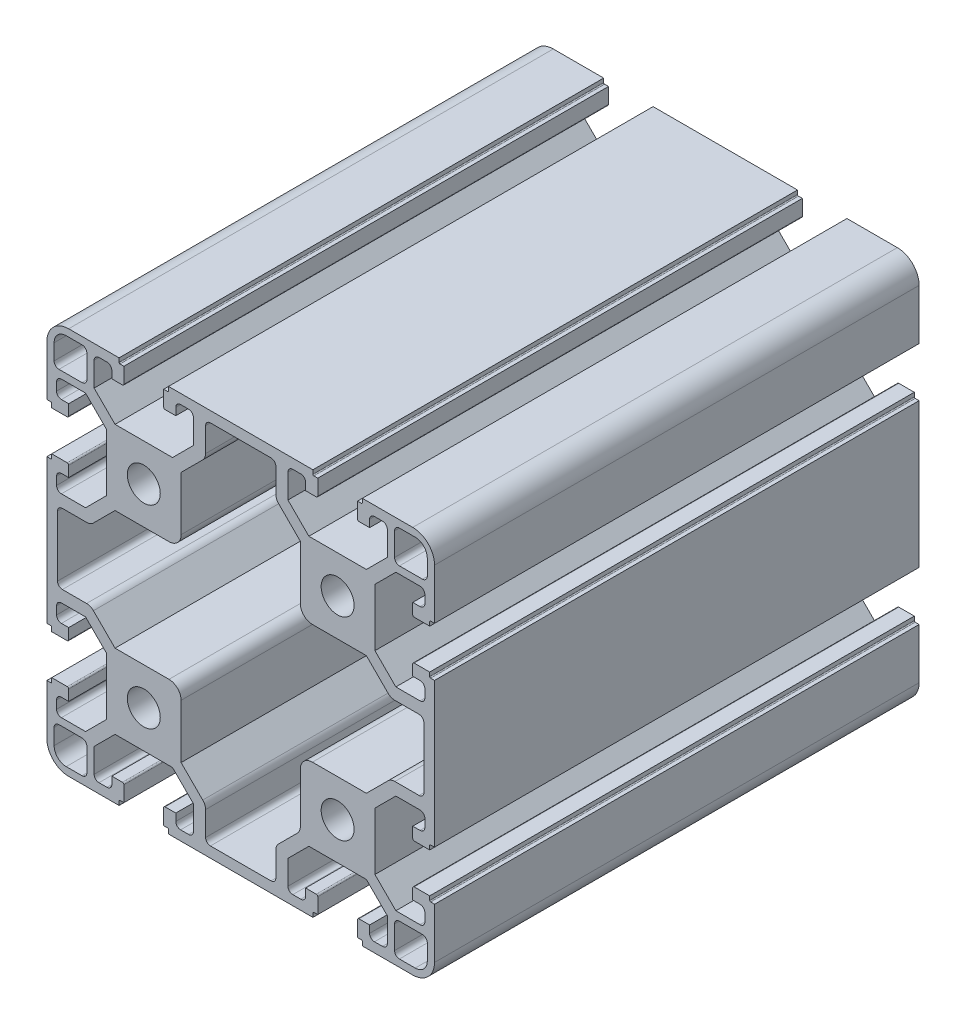
from build123d import *

# Parameters (mm, degrees)
SKETCH_1_R      = 3.4
EXTRUDE_1_DEPTH = 100


with BuildPart() as part:
    # 草图1 → 凸台-拉伸1 (new body)
    with BuildSketch(Plane.XY):
        with BuildLine():
            Line((28.48472507, 26.552635346), (32.802492023, 30.870402299))
            Line((32.802492023, 30.870402299), (37.78472507, 30.870402299))
            ThreePointArc((37.78472507, 30.870402299), (38.491831851, 30.57750908), (38.78472507, 29.870402299))
            Line((38.78472507, 29.870402299), (38.78472507, 28.220402299))
            ThreePointArc((38.78472507, 28.220402299), (38.491831851, 27.513295518), (37.78472507, 27.220402299))
            Line((37.78472507, 27.220402299), (36.28472507, 27.220402299))
            Line((36.28472507, 27.220402299), (36.28472507, 25.020402299))
            ThreePointArc((36.28472507, 25.020402299), (36.372593036, 24.808270264), (36.58472507, 24.720402299))
            Line((36.58472507, 24.720402299), (39.78472507, 24.720402299))
            Line((39.78472507, 24.720402299), (39.78472507, 25.520402299))
            ThreePointArc((39.78472507, 25.520402299), (39.843303714, 25.661823655), (39.98472507, 25.720402299))
            Line((39.98472507, 25.720402299), (40.78472507, 25.720402299))
            Line((40.78472507, 25.720402299), (40.78472507, 36.120402299))
            ThreePointArc((40.78472507, 36.120402299), (39.466705585, 39.302382814), (36.28472507, 40.620402299))
            Line((36.28472507, 40.620402299), (25.88472507, 40.620402299))
            Line((25.88472507, 40.620402299), (25.88472507, 39.820402299))
            ThreePointArc((25.88472507, 39.820402299), (25.826146426, 39.678980943), (25.68472507, 39.620402299))
            Line((25.68472507, 39.620402299), (24.88472507, 39.620402299))
            Line((24.88472507, 39.620402299), (24.88472507, 36.420402299))
            ThreePointArc((24.88472507, 36.420402299), (24.972593036, 36.208270264), (25.18472507, 36.120402299))
            Line((25.18472507, 36.120402299), (27.38472507, 36.120402299))
            Line((27.38472507, 36.120402299), (27.38472507, 37.620402299))
            ThreePointArc((27.38472507, 37.620402299), (27.677618289, 38.32750908), (28.38472507, 38.620402299))
            Line((28.38472507, 38.620402299), (30.03472507, 38.620402299))
            ThreePointArc((30.03472507, 38.620402299), (30.741831851, 38.32750908), (31.03472507, 37.620402299))
            Line((31.03472507, 37.620402299), (31.03472507, 32.638169252))
            Line((31.03472507, 32.638169252), (26.716958117, 28.320402299))
            Line((26.716958117, 28.320402299), (14.852492023, 28.320402299))
            Line((14.852492023, 28.320402299), (10.53472507, 32.638169252))
            Line((10.53472507, 32.638169252), (10.53472507, 37.620402299))
            ThreePointArc((10.53472507, 37.620402299), (10.827618289, 38.32750908), (11.53472507, 38.620402299))
            Line((11.53472507, 38.620402299), (13.18472507, 38.620402299))
            ThreePointArc((13.18472507, 38.620402299), (13.891831851, 38.32750908), (14.18472507, 37.620402299))
            Line((14.18472507, 37.620402299), (14.18472507, 36.120402299))
            Line((14.18472507, 36.120402299), (16.38472507, 36.120402299))
            ThreePointArc((16.38472507, 36.120402299), (16.596857104, 36.208270264), (16.68472507, 36.420402299))
            Line((16.68472507, 36.420402299), (16.68472507, 39.620402299))
            Line((16.68472507, 39.620402299), (15.88472507, 39.620402299))
            ThreePointArc((15.88472507, 39.620402299), (15.743303714, 39.678980943), (15.68472507, 39.820402299))
            Line((15.68472507, 39.820402299), (15.68472507, 40.620402299))
            Line((15.68472507, 40.620402299), (5.28472507, 40.620402299))
            Line((5.28472507, 40.620402299), (-3.71527493, 40.620402299))
            Line((-3.71527493, 40.620402299), (-14.11527493, 40.620402299))
            Line((-14.11527493, 40.620402299), (-14.11527493, 39.820402299))
            ThreePointArc((-14.11527493, 39.820402299), (-14.173853574, 39.678980943), (-14.31527493, 39.620402299))
            Line((-14.31527493, 39.620402299), (-15.11527493, 39.620402299))
            Line((-15.11527493, 39.620402299), (-15.11527493, 36.420402299))
            ThreePointArc((-15.11527493, 36.420402299), (-15.027406964, 36.208270264), (-14.81527493, 36.120402299))
            Line((-14.81527493, 36.120402299), (-12.61527493, 36.120402299))
            Line((-12.61527493, 36.120402299), (-12.61527493, 37.620402299))
            ThreePointArc((-12.61527493, 37.620402299), (-12.322381711, 38.32750908), (-11.61527493, 38.620402299))
            Line((-11.61527493, 38.620402299), (-9.96527493, 38.620402299))
            ThreePointArc((-9.96527493, 38.620402299), (-9.258168149, 38.32750908), (-8.96527493, 37.620402299))
            Line((-8.96527493, 37.620402299), (-8.96527493, 32.638169252))
            Line((-8.96527493, 32.638169252), (-13.283041883, 28.320402299))
            Line((-13.283041883, 28.320402299), (-25.147507977, 28.320402299))
            Line((-25.147507977, 28.320402299), (-29.46527493, 32.638169252))
            Line((-29.46527493, 32.638169252), (-29.46527493, 37.620402299))
            ThreePointArc((-29.46527493, 37.620402299), (-29.172381711, 38.32750908), (-28.46527493, 38.620402299))
            Line((-28.46527493, 38.620402299), (-26.81527493, 38.620402299))
            ThreePointArc((-26.81527493, 38.620402299), (-26.108168149, 38.32750908), (-25.81527493, 37.620402299))
            Line((-25.81527493, 37.620402299), (-25.81527493, 36.120402299))
            Line((-25.81527493, 36.120402299), (-23.61527493, 36.120402299))
            ThreePointArc((-23.61527493, 36.120402299), (-23.403142896, 36.208270264), (-23.31527493, 36.420402299))
            Line((-23.31527493, 36.420402299), (-23.31527493, 39.620402299))
            Line((-23.31527493, 39.620402299), (-24.11527493, 39.620402299))
            ThreePointArc((-24.11527493, 39.620402299), (-24.256696286, 39.678980943), (-24.31527493, 39.820402299))
            Line((-24.31527493, 39.820402299), (-24.31527493, 40.620402299))
            Line((-24.31527493, 40.620402299), (-34.71527493, 40.620402299))
            ThreePointArc((-34.71527493, 40.620402299), (-37.897255445, 39.302382814), (-39.21527493, 36.120402299))
            Line((-39.21527493, 36.120402299), (-39.21527493, 25.720402299))
            Line((-39.21527493, 25.720402299), (-38.41527493, 25.720402299))
            ThreePointArc((-38.41527493, 25.720402299), (-38.273853574, 25.661823655), (-38.21527493, 25.520402299))
            Line((-38.21527493, 25.520402299), (-38.21527493, 24.720402299))
            Line((-38.21527493, 24.720402299), (-35.01527493, 24.720402299))
            ThreePointArc((-35.01527493, 24.720402299), (-34.803142896, 24.808270264), (-34.71527493, 25.020402299))
            Line((-34.71527493, 25.020402299), (-34.71527493, 27.220402299))
            Line((-34.71527493, 27.220402299), (-36.21527493, 27.220402299))
            ThreePointArc((-36.21527493, 27.220402299), (-36.922381711, 27.513295518), (-37.21527493, 28.220402299))
            Line((-37.21527493, 28.220402299), (-37.21527493, 29.870402299))
            ThreePointArc((-37.21527493, 29.870402299), (-36.922381711, 30.57750908), (-36.21527493, 30.870402299))
            Line((-36.21527493, 30.870402299), (-31.233041883, 30.870402299))
            Line((-31.233041883, 30.870402299), (-26.91527493, 26.552635346))
            Line((-26.91527493, 26.552635346), (-26.91527493, 14.688169252))
            Line((-26.91527493, 14.688169252), (-31.233041883, 10.370402299))
            Line((-31.233041883, 10.370402299), (-36.21527493, 10.370402299))
            ThreePointArc((-36.21527493, 10.370402299), (-36.922381711, 10.663295518), (-37.21527493, 11.370402299))
            Line((-37.21527493, 11.370402299), (-37.21527493, 13.020402299))
            ThreePointArc((-37.21527493, 13.020402299), (-36.922381711, 13.72750908), (-36.21527493, 14.020402299))
            Line((-36.21527493, 14.020402299), (-34.71527493, 14.020402299))
            Line((-34.71527493, 14.020402299), (-34.71527493, 16.220402299))
            ThreePointArc((-34.71527493, 16.220402299), (-34.803142896, 16.432534333), (-35.01527493, 16.520402299))
            Line((-35.01527493, 16.520402299), (-38.21527493, 16.520402299))
            Line((-38.21527493, 16.520402299), (-38.21527493, 15.720402299))
            ThreePointArc((-38.21527493, 15.720402299), (-38.273853574, 15.578980943), (-38.41527493, 15.520402299))
            Line((-38.41527493, 15.520402299), (-39.21527493, 15.520402299))
            Line((-39.21527493, 15.520402299), (-39.21527493, 5.120402299))
            Line((-39.21527493, 5.120402299), (-39.21527493, -3.879597701))
            Line((-39.21527493, -3.879597701), (-39.21527493, -14.279597701))
            Line((-39.21527493, -14.279597701), (-38.41527493, -14.279597701))
            ThreePointArc((-38.41527493, -14.279597701), (-38.273853574, -14.338176345), (-38.21527493, -14.479597701))
            Line((-38.21527493, -14.479597701), (-38.21527493, -15.279597701))
            Line((-38.21527493, -15.279597701), (-35.01527493, -15.279597701))
            ThreePointArc((-35.01527493, -15.279597701), (-34.803142896, -15.191729736), (-34.71527493, -14.979597701))
            Line((-34.71527493, -14.979597701), (-34.71527493, -12.779597701))
            Line((-34.71527493, -12.779597701), (-36.21527493, -12.779597701))
            ThreePointArc((-36.21527493, -12.779597701), (-36.922381711, -12.486704482), (-37.21527493, -11.779597701))
            Line((-37.21527493, -11.779597701), (-37.21527493, -10.129597701))
            ThreePointArc((-37.21527493, -10.129597701), (-36.922381711, -9.42249092), (-36.21527493, -9.129597701))
            Line((-36.21527493, -9.129597701), (-31.233041883, -9.129597701))
            Line((-31.233041883, -9.129597701), (-26.91527493, -13.447364654))
            Line((-26.91527493, -13.447364654), (-26.91527493, -25.311830748))
            Line((-26.91527493, -25.311830748), (-31.233041883, -29.629597701))
            Line((-31.233041883, -29.629597701), (-36.21527493, -29.629597701))
            ThreePointArc((-36.21527493, -29.629597701), (-36.922381711, -29.336704482), (-37.21527493, -28.629597701))
            Line((-37.21527493, -28.629597701), (-37.21527493, -26.979597701))
            ThreePointArc((-37.21527493, -26.979597701), (-36.922381711, -26.27249092), (-36.21527493, -25.979597701))
            Line((-36.21527493, -25.979597701), (-34.71527493, -25.979597701))
            Line((-34.71527493, -25.979597701), (-34.71527493, -23.779597701))
            ThreePointArc((-34.71527493, -23.779597701), (-34.803142896, -23.567465667), (-35.01527493, -23.479597701))
            Line((-35.01527493, -23.479597701), (-38.21527493, -23.479597701))
            Line((-38.21527493, -23.479597701), (-38.21527493, -24.279597701))
            ThreePointArc((-38.21527493, -24.279597701), (-38.273853574, -24.421019057), (-38.41527493, -24.479597701))
            Line((-38.41527493, -24.479597701), (-39.21527493, -24.479597701))
            Line((-39.21527493, -24.479597701), (-39.21527493, -34.879597701))
            ThreePointArc((-39.21527493, -34.879597701), (-37.897255445, -38.061578216), (-34.71527493, -39.379597701))
            Line((-34.71527493, -39.379597701), (-24.31527493, -39.379597701))
            Line((-24.31527493, -39.379597701), (-24.31527493, -38.579597701))
            ThreePointArc((-24.31527493, -38.579597701), (-24.256696286, -38.438176345), (-24.11527493, -38.379597701))
            Line((-24.11527493, -38.379597701), (-23.31527493, -38.379597701))
            Line((-23.31527493, -38.379597701), (-23.31527493, -35.179597701))
            ThreePointArc((-23.31527493, -35.179597701), (-23.403142896, -34.967465667), (-23.61527493, -34.879597701))
            Line((-23.61527493, -34.879597701), (-25.81527493, -34.879597701))
            Line((-25.81527493, -34.879597701), (-25.81527493, -36.379597701))
            ThreePointArc((-25.81527493, -36.379597701), (-26.108168149, -37.086704482), (-26.81527493, -37.379597701))
            Line((-26.81527493, -37.379597701), (-28.46527493, -37.379597701))
            ThreePointArc((-28.46527493, -37.379597701), (-29.172381711, -37.086704482), (-29.46527493, -36.379597701))
            Line((-29.46527493, -36.379597701), (-29.46527493, -31.397364654))
            Line((-29.46527493, -31.397364654), (-25.147507977, -27.079597701))
            Line((-25.147507977, -27.079597701), (-13.283041883, -27.079597701))
            Line((-13.283041883, -27.079597701), (-8.96527493, -31.397364654))
            Line((-8.96527493, -31.397364654), (-8.96527493, -36.379597701))
            ThreePointArc((-8.96527493, -36.379597701), (-9.258168149, -37.086704482), (-9.96527493, -37.379597701))
            Line((-9.96527493, -37.379597701), (-11.61527493, -37.379597701))
            ThreePointArc((-11.61527493, -37.379597701), (-12.322381711, -37.086704482), (-12.61527493, -36.379597701))
            Line((-12.61527493, -36.379597701), (-12.61527493, -34.879597701))
            Line((-12.61527493, -34.879597701), (-14.81527493, -34.879597701))
            ThreePointArc((-14.81527493, -34.879597701), (-15.027406964, -34.967465667), (-15.11527493, -35.179597701))
            Line((-15.11527493, -35.179597701), (-15.11527493, -38.379597701))
            Line((-15.11527493, -38.379597701), (-14.31527493, -38.379597701))
            ThreePointArc((-14.31527493, -38.379597701), (-14.173853574, -38.438176345), (-14.11527493, -38.579597701))
            Line((-14.11527493, -38.579597701), (-14.11527493, -39.379597701))
            Line((-14.11527493, -39.379597701), (-3.71527493, -39.379597701))
            Line((-3.71527493, -39.379597701), (5.28472507, -39.379597701))
            Line((5.28472507, -39.379597701), (15.68472507, -39.379597701))
            Line((15.68472507, -39.379597701), (15.68472507, -38.579597701))
            ThreePointArc((15.68472507, -38.579597701), (15.743303714, -38.438176345), (15.88472507, -38.379597701))
            Line((15.88472507, -38.379597701), (16.68472507, -38.379597701))
            Line((16.68472507, -38.379597701), (16.68472507, -35.179597701))
            ThreePointArc((16.68472507, -35.179597701), (16.596857104, -34.967465667), (16.38472507, -34.879597701))
            Line((16.38472507, -34.879597701), (14.18472507, -34.879597701))
            Line((14.18472507, -34.879597701), (14.18472507, -36.379597701))
            ThreePointArc((14.18472507, -36.379597701), (13.891831851, -37.086704482), (13.18472507, -37.379597701))
            Line((13.18472507, -37.379597701), (11.53472507, -37.379597701))
            ThreePointArc((11.53472507, -37.379597701), (10.827618289, -37.086704482), (10.53472507, -36.379597701))
            Line((10.53472507, -36.379597701), (10.53472507, -31.397364654))
            Line((10.53472507, -31.397364654), (14.852492023, -27.079597701))
            Line((14.852492023, -27.079597701), (26.716958117, -27.079597701))
            Line((26.716958117, -27.079597701), (31.03472507, -31.397364654))
            Line((31.03472507, -31.397364654), (31.03472507, -36.379597701))
            ThreePointArc((31.03472507, -36.379597701), (30.741831851, -37.086704482), (30.03472507, -37.379597701))
            Line((30.03472507, -37.379597701), (28.38472507, -37.379597701))
            ThreePointArc((28.38472507, -37.379597701), (27.677618289, -37.086704482), (27.38472507, -36.379597701))
            Line((27.38472507, -36.379597701), (27.38472507, -34.879597701))
            Line((27.38472507, -34.879597701), (25.18472507, -34.879597701))
            ThreePointArc((25.18472507, -34.879597701), (24.972593036, -34.967465667), (24.88472507, -35.179597701))
            Line((24.88472507, -35.179597701), (24.88472507, -38.379597701))
            Line((24.88472507, -38.379597701), (25.68472507, -38.379597701))
            ThreePointArc((25.68472507, -38.379597701), (25.826146426, -38.438176345), (25.88472507, -38.579597701))
            Line((25.88472507, -38.579597701), (25.88472507, -39.379597701))
            Line((25.88472507, -39.379597701), (36.28472507, -39.379597701))
            ThreePointArc((36.28472507, -39.379597701), (39.466705585, -38.061578216), (40.78472507, -34.879597701))
            Line((40.78472507, -34.879597701), (40.78472507, -24.479597701))
            Line((40.78472507, -24.479597701), (39.98472507, -24.479597701))
            ThreePointArc((39.98472507, -24.479597701), (39.843303714, -24.421019057), (39.78472507, -24.279597701))
            Line((39.78472507, -24.279597701), (39.78472507, -23.479597701))
            Line((39.78472507, -23.479597701), (36.58472507, -23.479597701))
            ThreePointArc((36.58472507, -23.479597701), (36.372593036, -23.567465667), (36.28472507, -23.779597701))
            Line((36.28472507, -23.779597701), (36.28472507, -25.979597701))
            Line((36.28472507, -25.979597701), (37.78472507, -25.979597701))
            ThreePointArc((37.78472507, -25.979597701), (38.491831851, -26.27249092), (38.78472507, -26.979597701))
            Line((38.78472507, -26.979597701), (38.78472507, -28.629597701))
            ThreePointArc((38.78472507, -28.629597701), (38.491831851, -29.336704482), (37.78472507, -29.629597701))
            Line((37.78472507, -29.629597701), (32.802492023, -29.629597701))
            Line((32.802492023, -29.629597701), (28.48472507, -25.311830748))
            Line((28.48472507, -25.311830748), (28.48472507, -13.447364654))
            Line((28.48472507, -13.447364654), (32.802492023, -9.129597701))
            Line((32.802492023, -9.129597701), (37.78472507, -9.129597701))
            ThreePointArc((37.78472507, -9.129597701), (38.491831851, -9.42249092), (38.78472507, -10.129597701))
            Line((38.78472507, -10.129597701), (38.78472507, -11.779597701))
            ThreePointArc((38.78472507, -11.779597701), (38.491831851, -12.486704482), (37.78472507, -12.779597701))
            Line((37.78472507, -12.779597701), (36.28472507, -12.779597701))
            Line((36.28472507, -12.779597701), (36.28472507, -14.979597701))
            ThreePointArc((36.28472507, -14.979597701), (36.372593036, -15.191729736), (36.58472507, -15.279597701))
            Line((36.58472507, -15.279597701), (39.78472507, -15.279597701))
            Line((39.78472507, -15.279597701), (39.78472507, -14.479597701))
            ThreePointArc((39.78472507, -14.479597701), (39.843303714, -14.338176345), (39.98472507, -14.279597701))
            Line((39.98472507, -14.279597701), (40.78472507, -14.279597701))
            Line((40.78472507, -14.279597701), (40.78472507, -3.879597701))
            Line((40.78472507, -3.879597701), (40.78472507, 5.120402299))
            Line((40.78472507, 5.120402299), (40.78472507, 15.520402299))
            Line((40.78472507, 15.520402299), (39.98472507, 15.520402299))
            ThreePointArc((39.98472507, 15.520402299), (39.843303714, 15.578980943), (39.78472507, 15.720402299))
            Line((39.78472507, 15.720402299), (39.78472507, 16.520402299))
            Line((39.78472507, 16.520402299), (36.58472507, 16.520402299))
            ThreePointArc((36.58472507, 16.520402299), (36.372593036, 16.432534333), (36.28472507, 16.220402299))
            Line((36.28472507, 16.220402299), (36.28472507, 14.020402299))
            Line((36.28472507, 14.020402299), (37.78472507, 14.020402299))
            ThreePointArc((37.78472507, 14.020402299), (38.491831851, 13.72750908), (38.78472507, 13.020402299))
            Line((38.78472507, 13.020402299), (38.78472507, 11.370402299))
            ThreePointArc((38.78472507, 11.370402299), (38.491831851, 10.663295518), (37.78472507, 10.370402299))
            Line((37.78472507, 10.370402299), (32.802492023, 10.370402299))
            Line((32.802492023, 10.370402299), (28.48472507, 14.688169252))
            Line((28.48472507, 14.688169252), (28.48472507, 26.552635346))
        make_face()
        with Locations((20.78472507, -19.379597701)):
            Circle(SKETCH_1_R, mode=Mode.SUBTRACT)
        with Locations((-19.21527493, -19.379597701)):
            Circle(SKETCH_1_R, mode=Mode.SUBTRACT)
        with Locations((20.78472507, 20.620402299)):
            Circle(SKETCH_1_R, mode=Mode.SUBTRACT)
        with Locations((-19.21527493, 20.620402299)):
            Circle(SKETCH_1_R, mode=Mode.SUBTRACT)
        with BuildLine():
            Line((33.53472507, -31.129597701), (38.28872507, -31.129597701))
            ThreePointArc((38.28872507, -31.129597701), (38.995831851, -31.42249092), (39.28872507, -32.129597701))
            Line((39.28872507, -32.129597701), (39.28872507, -35.383597701))
            ThreePointArc((39.28872507, -35.383597701), (38.556492023, -37.151364654), (36.78872507, -37.883597701))
            Line((36.78872507, -37.883597701), (33.53472507, -37.883597701))
            ThreePointArc((33.53472507, -37.883597701), (32.827618289, -37.590704482), (32.53472507, -36.883597701))
            Line((32.53472507, -36.883597701), (32.53472507, -32.129597701))
            ThreePointArc((32.53472507, -32.129597701), (32.827618289, -31.42249092), (33.53472507, -31.129597701))
        make_face(mode=Mode.SUBTRACT)
        with BuildLine():
            Line((-30.96527493, -32.129597701), (-30.96527493, -36.883597701))
            ThreePointArc((-30.96527493, -36.883597701), (-31.258168149, -37.590704482), (-31.96527493, -37.883597701))
            Line((-31.96527493, -37.883597701), (-35.21927493, -37.883597701))
            ThreePointArc((-35.21927493, -37.883597701), (-36.987041883, -37.151364654), (-37.71927493, -35.383597701))
            Line((-37.71927493, -35.383597701), (-37.71927493, -32.129597701))
            ThreePointArc((-37.71927493, -32.129597701), (-37.426381711, -31.42249092), (-36.71927493, -31.129597701))
            Line((-36.71927493, -31.129597701), (-31.96527493, -31.129597701))
            ThreePointArc((-31.96527493, -31.129597701), (-31.258168149, -31.42249092), (-30.96527493, -32.129597701))
        make_face(mode=Mode.SUBTRACT)
        with BuildLine():
            Line((32.53472507, 33.370402299), (32.53472507, 38.124402299))
            ThreePointArc((32.53472507, 38.124402299), (32.827618289, 38.83150908), (33.53472507, 39.124402299))
            Line((33.53472507, 39.124402299), (36.78872507, 39.124402299))
            ThreePointArc((36.78872507, 39.124402299), (38.556492023, 38.392169252), (39.28872507, 36.624402299))
            Line((39.28872507, 36.624402299), (39.28872507, 33.370402299))
            ThreePointArc((39.28872507, 33.370402299), (38.995831851, 32.663295518), (38.28872507, 32.370402299))
            Line((38.28872507, 32.370402299), (33.53472507, 32.370402299))
            ThreePointArc((33.53472507, 32.370402299), (32.827618289, 32.663295518), (32.53472507, 33.370402299))
        make_face(mode=Mode.SUBTRACT)
        with BuildLine():
            Line((-31.96527493, 32.370402299), (-36.71927493, 32.370402299))
            ThreePointArc((-36.71927493, 32.370402299), (-37.426381711, 32.663295518), (-37.71927493, 33.370402299))
            Line((-37.71927493, 33.370402299), (-37.71927493, 36.624402299))
            ThreePointArc((-37.71927493, 36.624402299), (-36.987041883, 38.392169252), (-35.21927493, 39.124402299))
            Line((-35.21927493, 39.124402299), (-31.96527493, 39.124402299))
            ThreePointArc((-31.96527493, 39.124402299), (-31.258168149, 38.83150908), (-30.96527493, 38.124402299))
            Line((-30.96527493, 38.124402299), (-30.96527493, 33.370402299))
            ThreePointArc((-30.96527493, 33.370402299), (-31.258168149, 32.663295518), (-31.96527493, 32.370402299))
        make_face(mode=Mode.SUBTRACT)
        with BuildLine():
            Line((-11.51527493, 26.552635346), (-7.051061368, 31.016848908))
            ThreePointArc((-7.051061368, 31.016848908), (-6.617515865, 31.665695606), (-6.46527493, 32.431062471))
            Line((-6.46527493, 32.431062471), (-6.46527493, 37.420402299))
            ThreePointArc((-6.46527493, 37.420402299), (-6.172381711, 38.12750908), (-5.46527493, 38.420402299))
            Line((-5.46527493, 38.420402299), (7.03472507, 38.420402299))
            ThreePointArc((7.03472507, 38.420402299), (7.741831851, 38.12750908), (8.03472507, 37.420402299))
            Line((8.03472507, 37.420402299), (8.03472507, 32.431062471))
            ThreePointArc((8.03472507, 32.431062471), (8.186966005, 31.665695606), (8.620511508, 31.016848908))
            Line((8.620511508, 31.016848908), (13.08472507, 26.552635346))
            Line((13.08472507, 26.552635346), (13.08472507, 15.420402299))
            ThreePointArc((13.08472507, 15.420402299), (13.816958117, 13.652635346), (15.58472507, 12.920402299))
            Line((15.58472507, 12.920402299), (26.716958117, 12.920402299))
            Line((26.716958117, 12.920402299), (31.181171679, 8.456188736))
            ThreePointArc((31.181171679, 8.456188736), (31.830018377, 8.022643234), (32.595385242, 7.870402299))
            Line((32.595385242, 7.870402299), (37.58472507, 7.870402299))
            ThreePointArc((37.58472507, 7.870402299), (38.291831851, 7.57750908), (38.58472507, 6.870402299))
            Line((38.58472507, 6.870402299), (38.58472507, -5.629597701))
            ThreePointArc((38.58472507, -5.629597701), (38.291831851, -6.336704482), (37.58472507, -6.629597701))
            Line((37.58472507, -6.629597701), (32.595385242, -6.629597701))
            ThreePointArc((32.595385242, -6.629597701), (31.830018377, -6.781838636), (31.181171679, -7.215384139))
            Line((31.181171679, -7.215384139), (26.716958117, -11.679597701))
            Line((26.716958117, -11.679597701), (15.58472507, -11.679597701))
            ThreePointArc((15.58472507, -11.679597701), (13.816958117, -12.411830748), (13.08472507, -14.179597701))
            Line((13.08472507, -14.179597701), (13.08472507, -24.483403623))
            ThreePointArc((13.08472507, -24.483403623), (12.932484135, -25.248770488), (12.498938632, -25.897617186))
            Line((12.498938632, -25.897617186), (8.620511508, -29.776044311))
            ThreePointArc((8.620511508, -29.776044311), (8.186966005, -30.424891008), (8.03472507, -31.190257873))
            Line((8.03472507, -31.190257873), (8.03472507, -36.179597701))
            ThreePointArc((8.03472507, -36.179597701), (7.741831851, -36.886704482), (7.03472507, -37.179597701))
            Line((7.03472507, -37.179597701), (-5.46527493, -37.179597701))
            ThreePointArc((-5.46527493, -37.179597701), (-6.172381711, -36.886704482), (-6.46527493, -36.179597701))
            Line((-6.46527493, -36.179597701), (-6.46527493, -31.190257873))
            ThreePointArc((-6.46527493, -31.190257873), (-6.617515865, -30.424891008), (-7.051061368, -29.776044311))
            Line((-7.051061368, -29.776044311), (-11.51527493, -25.311830748))
            Line((-11.51527493, -25.311830748), (-11.51527493, -14.179597701))
            ThreePointArc((-11.51527493, -14.179597701), (-12.247507977, -12.411830748), (-14.01527493, -11.679597701))
            Line((-14.01527493, -11.679597701), (-25.147507977, -11.679597701))
            Line((-25.147507977, -11.679597701), (-29.61172154, -7.215384139))
            ThreePointArc((-29.61172154, -7.215384139), (-30.260568237, -6.781838636), (-31.025935102, -6.629597701))
            Line((-31.025935102, -6.629597701), (-36.01527493, -6.629597701))
            ThreePointArc((-36.01527493, -6.629597701), (-36.722381711, -6.336704482), (-37.01527493, -5.629597701))
            Line((-37.01527493, -5.629597701), (-37.01527493, 6.870402299))
            ThreePointArc((-37.01527493, 6.870402299), (-36.722381711, 7.57750908), (-36.01527493, 7.870402299))
            Line((-36.01527493, 7.870402299), (-31.025935102, 7.870402299))
            ThreePointArc((-31.025935102, 7.870402299), (-30.260568237, 8.022643234), (-29.61172154, 8.456188736))
            Line((-29.61172154, 8.456188736), (-25.147507977, 12.920402299))
            Line((-25.147507977, 12.920402299), (-14.01527493, 12.920402299))
            ThreePointArc((-14.01527493, 12.920402299), (-12.247507977, 13.652635346), (-11.51527493, 15.420402299))
            Line((-11.51527493, 15.420402299), (-11.51527493, 26.552635346))
        make_face(mode=Mode.SUBTRACT)
    extrude(amount=EXTRUDE_1_DEPTH)


solid = part.part
